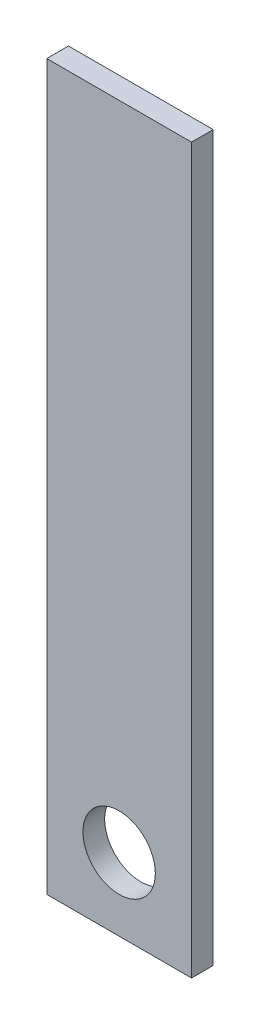
from build123d import *

# Parameters (mm, degrees)
SKETCH1_W      = 20
SKETCH1_H      = 100
EXTRUDE1_DEPTH = 3
SKETCH2_R      = 5
EXTRUDE2_DEPTH = 103.02450686


with BuildPart() as part:
    # Sketch1 → Extrude1 (new body)
    with BuildSketch(Plane.XY):
        with Locations((10, 50)):
            Rectangle(SKETCH1_W, SKETCH1_H)
    extrude(amount=EXTRUDE1_DEPTH)

    # Sketch2 → Extrude2 (cut, through all)
    with BuildSketch(Plane.XY.offset(3)):
        with Locations((10, 10)):
            Circle(SKETCH2_R)
    extrude(amount=-EXTRUDE2_DEPTH, mode=Mode.SUBTRACT)


solid = part.part
